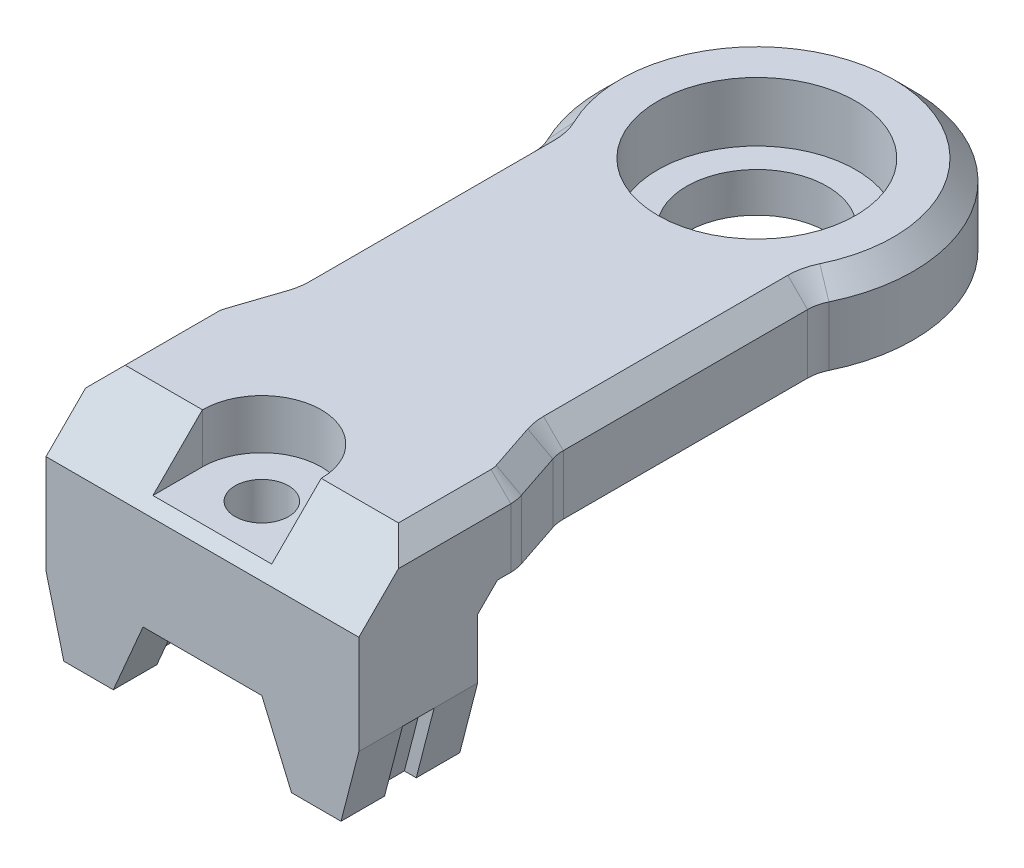
from build123d import *
from build123d.topology import SkipClean

# Parameters (mm, degrees)
EXTRUDE_1_DEPTH     = 4
EXTRUDE_3_DEPTH     = 6
CHAMFER_1_SIZE      = 3
CUT_EXTRUDE_2_DEPTH = 2.5
CUT_EXTRUDE_3_REACH = 32.453
SKETCH_7_R          = 1.35
SKETCH_8_R          = 6
EXTRUDE_4_DEPTH     = 1
FILLET_1_R          = 0.5
SKETCH_9_R          = 5
CUT_EXTRUDE_4_DEPTH = 3
SKETCH_10_R         = 3.55
CUT_EXTRUDE_5_DEPTH = 3.6
CUT_EXTRUDE_6_DEPTH = 0.8
CUT_EXTRUDE_7_DEPTH = 32.283541999
FILLET_2_R          = 2
CHAMFER_2_SIZE      = 1


with BuildPart() as part:
    # ｽｹｯﾁ1 → ﾎﾞｽ - 押し出し1 (new body)
    with BuildSketch(Plane(origin=(0, 0, 0), x_dir=(1, 0, 0), z_dir=(0, 1, 0))):
        with BuildLine():
            Line((-7.9, 0), (-7.9, -28))
            Line((-7.9, -28), (7.9, -28))
            Line((7.9, -28), (7.9, 0))
            ThreePointArc((7.9, 0), (0, 7.9), (-7.9, 0))
        make_face()
    extrude(amount=EXTRUDE_1_DEPTH)

    # ｽｹｯﾁ4 → ﾎﾞｽ - 押し出し3 (add)
    with BuildSketch(Plane.XY.offset(28)):
        Polygon((-7, -7.5), (-4.5, -7.5), (-3, -4), (3, -4), (4.5, -7.5), (7, -7.5), (7.9, -4), (7.9, 0), (-7.9, 0), (-7.9, -4), align=None)
    extrude(amount=-EXTRUDE_3_DEPTH)

    # 面取り1
    chamfer_1_edges = [part.edges().sort_by_distance(p)[0] for p in [
        (0, 4, 28),
    ]]
    chamfer(chamfer_1_edges, length=CHAMFER_1_SIZE)

    # ｽｹｯﾁ6 → ｶｯﾄ - 押し出し2 (cut)
    with BuildSketch(Plane(origin=(0, 4, 0), x_dir=(1, 0, 0), z_dir=(0, 1, 0))):
        with BuildLine():
            Line((-3, -25), (-3, -29))
            Line((-3, -29), (3, -29))
            Line((3, -29), (3, -25))
            ThreePointArc((3, -25), (0, -22), (-3, -25))
        make_face()
    extrude(amount=-CUT_EXTRUDE_2_DEPTH, mode=Mode.SUBTRACT)

    # ｽｹｯﾁ7 → ｶｯﾄ - 押し出し3 (cut, up to next)
    with BuildSketch(Plane(origin=(0, 1.5, 0), x_dir=(1, 0, 0), z_dir=(0, 1, 0)), mode=Mode.PRIVATE) as cut_extrude_3_sk1:
        with Locations(Location((0, -25, 0), (0, 0, 270))):
            Circle(SKETCH_7_R)
    cut_extrude_3_tool1 = extrude(cut_extrude_3_sk1.sketch, amount=-CUT_EXTRUDE_3_REACH, mode=Mode.PRIVATE) & part.part
    add(cut_extrude_3_tool1.solids().sort_by_distance((0, 1.5, 25))[0], mode=Mode.SUBTRACT)

    # ｽｹｯﾁ8 → ﾎﾞｽ - 押し出し4 (add)
    with BuildSketch(Plane.XZ):
        with Locations(Location((0, 0, 0), (0, 0, 90))):
            Circle(SKETCH_8_R)
    extrude(amount=EXTRUDE_4_DEPTH)

    # ﾌｨﾚｯﾄ1
    fillet_1_edges = [part.edges().sort_by_distance(p)[0] for p in [
        (0, 0, -6),
    ]]
    fillet(fillet_1_edges, radius=FILLET_1_R)

    # ｽｹｯﾁ9 → ｶｯﾄ - 押し出し4 (cut)
    with BuildSketch(Plane(origin=(0, 4, 0), x_dir=(1, 0, 0), z_dir=(0, 1, 0))):
        with Locations(Location((0, 0, 0), (0, 0, 270))):
            Circle(SKETCH_9_R)
    extrude(amount=-CUT_EXTRUDE_4_DEPTH, mode=Mode.SUBTRACT)

    # ｽｹｯﾁ10 → ｶｯﾄ - 押し出し5 (cut)
    with BuildSketch(Plane(origin=(0, 1, 0), x_dir=(1, 0, 0), z_dir=(0, 1, 0))):
        with Locations(Location((0, 0, 0), (0, 0, 270))):
            Circle(SKETCH_10_R)
    extrude(amount=-CUT_EXTRUDE_5_DEPTH, mode=Mode.SUBTRACT)

    # ｽｹｯﾁ11 → ｶｯﾄ - 押し出し6 (cut, symmetric)
    with BuildSketch(Plane.XY.offset(25)):
        Polygon((3, -4), (4.5, -7.5), (5.1, -7.5), (3.6, -4), align=None)
        Polygon((6.4, -7.5), (7, -7.5), (7.9, -4), (7.3, -4), align=None)
    cut_extrude_6 = extrude(amount=CUT_EXTRUDE_6_DEPTH, both=True, mode=Mode.SUBTRACT)

    # ﾐﾗｰ1: ｶｯﾄ - 押し出し6 across plane
    add(cut_extrude_6.mirror(Plane(origin=(0, 0, 0), x_dir=(0, 0, 1), z_dir=(1, 0, 0))), mode=Mode.SUBTRACT)

    # ｽｹｯﾁ12 → ｶｯﾄ - 押し出し7 (cut, through all)
    with SkipClean():  # the faces are left unmerged after this step: merging them gives an invalid solid
        with BuildSketch(Plane(origin=(0, 4, 0), x_dir=(1, 0, 0), z_dir=(0, 1, 0))):
            with BuildLine():
                Line((-7.9, 0), (-7.9, -20))
                Line((-7.9, -20), (-6.9, -17))
                Line((-6.9, -17), (-6.9, -3.847076812))
                ThreePointArc((-6.9, -3.847076812), (-7.645913941, -1.987460691), (-7.9, 0))
            make_face()
        cut_extrude_7 = extrude(amount=-CUT_EXTRUDE_7_DEPTH, mode=Mode.SUBTRACT)

    # ﾐﾗｰ2: ｶｯﾄ - 押し出し7 across plane
    with SkipClean():  # the faces are left unmerged after this step: merging them gives an invalid solid
        add(cut_extrude_7.mirror(Plane(origin=(0, 0, 0), x_dir=(0, 0, 1), z_dir=(1, 0, 0))), mode=Mode.SUBTRACT)

    # ﾌｨﾚｯﾄ2
    fillet_2_edges = [part.edges().sort_by_distance(p)[0] for p in [
        (-6.9, 2, 3.847076812),
        (-6.9, 2, 17),
        (-7.9, 2, 20),
        (6.9, 2, 3.847076812),
        (7.9, 2, 20),
        (6.9, 2, 17),
    ]]
    fillet(fillet_2_edges, radius=FILLET_2_R)

    # 面取り2
    chamfer_2_edges = [part.edges().sort_by_distance(p)[0] for p in [
        (-7.9, 4, 22.66227766),
        (0, 4, -7.9),
        (7.9, 4, 22.66227766),
        (0, 0, 22),
        (-7.874174915, 4, 20.004190834),
        (-7.4, 4, 18.5),
        (-6.925825085, 4, 16.995809166),
        (-6.9, 4, 10.505670679),
        (-6.951159371, 4, 3.886430103),
        (6.951159371, 4, 3.886430103),
        (6.9, 4, 10.505670679),
        (6.925825085, 4, 16.995809166),
        (7.4, 4, 18.5),
        (7.874174915, 4, 20.004190834),
    ]]
    chamfer(chamfer_2_edges, length=CHAMFER_2_SIZE)


solid = part.part
